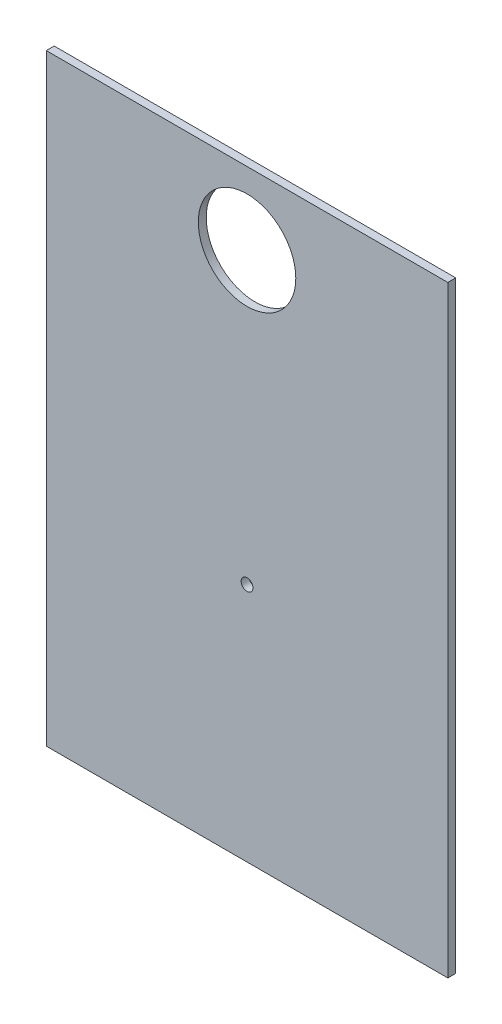
from build123d import *

# Parameters (mm, degrees)
SKETCH1_W           = 304.8
SKETCH1_H           = 457.2
BOSS_EXTRUDE1_DEPTH = 6
SKETCH2_R           = 37
SKETCH2_R_2         = 4.5
CUT_EXTRUDE1_DEPTH  = 275.808515152


with BuildPart() as part:
    # Sketch1 → Boss-Extrude1 (new body)
    with BuildSketch(Plane.XY):
        Rectangle(SKETCH1_W, SKETCH1_H)
    extrude(amount=BOSS_EXTRUDE1_DEPTH)

    # Sketch2 → Cut-Extrude1 (cut, through all)
    with BuildSketch(Plane.XY.offset(6)):
        with Locations((0, 173.6)):
            Circle(SKETCH2_R)
        with Locations((0, -46.2)):
            Circle(SKETCH2_R_2)
    extrude(amount=-CUT_EXTRUDE1_DEPTH, mode=Mode.SUBTRACT)


solid = part.part
